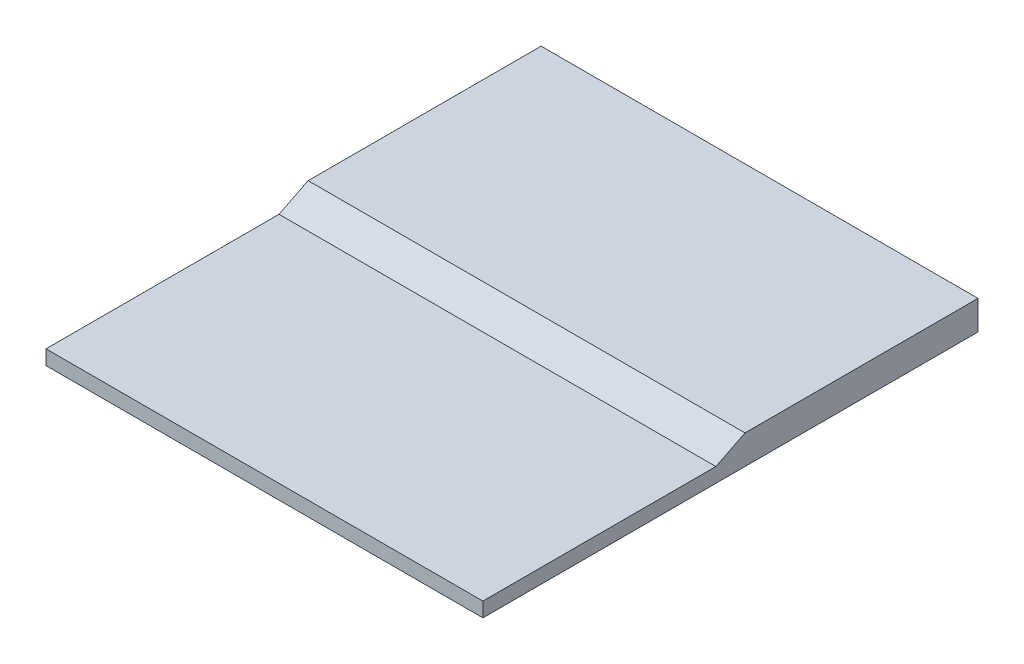
from build123d import *

# Parameters (mm, degrees)
BOSS_EXTRUDE1_DEPTH = 762


with BuildPart() as part:
    # Sketch1 → Boss-Extrude1 (new body)
    with BuildSketch(Plane(origin=(0, 0, 0), x_dir=(0, 0, -1), z_dir=(1, 0, 0))):
        Polygon((-406.4, 0), (0, 0), (50.8, 25.4), (457.2, 25.4), (457.2, -25.4), (-406.4, -25.4), align=None)
    extrude(amount=BOSS_EXTRUDE1_DEPTH)


solid = part.part
